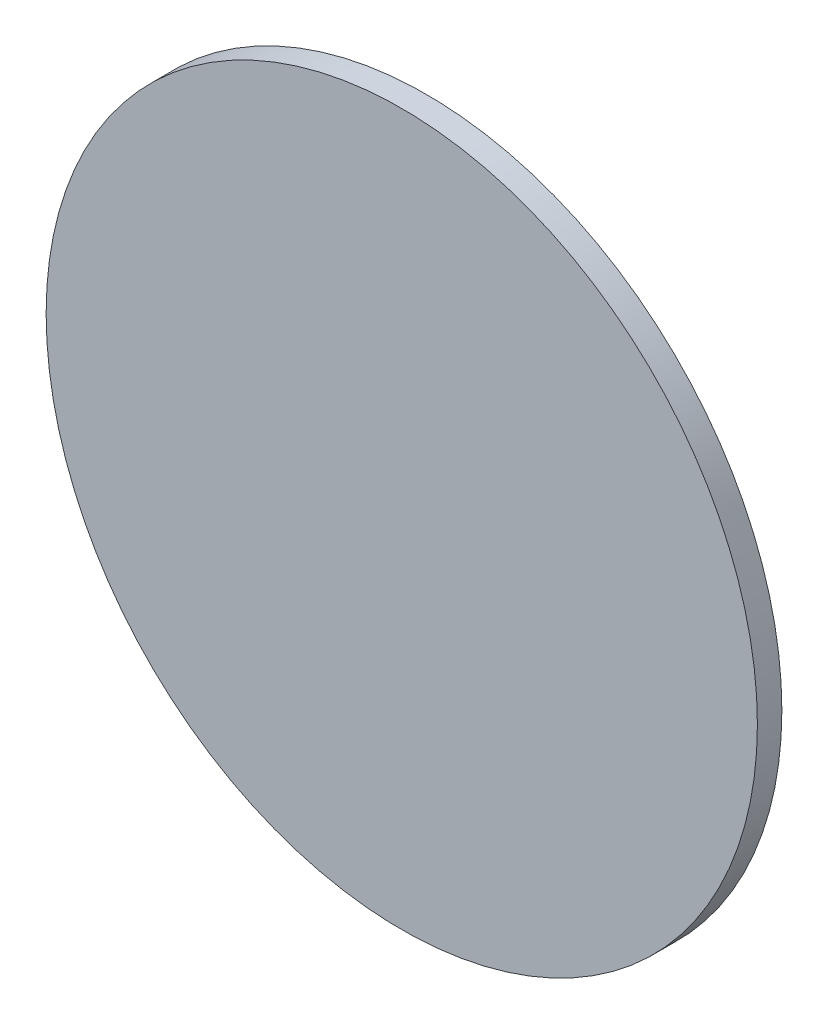
from build123d import *

# Parameters (mm, degrees)
SKETCH1_R           = 36.919131835
BOSS_EXTRUDE1_DEPTH = 2.54


with BuildPart() as part:
    # Sketch1 → Boss-Extrude1 (new body)
    with BuildSketch(Plane.XY):
        Circle(SKETCH1_R)
    extrude(amount=BOSS_EXTRUDE1_DEPTH)


solid = part.part
